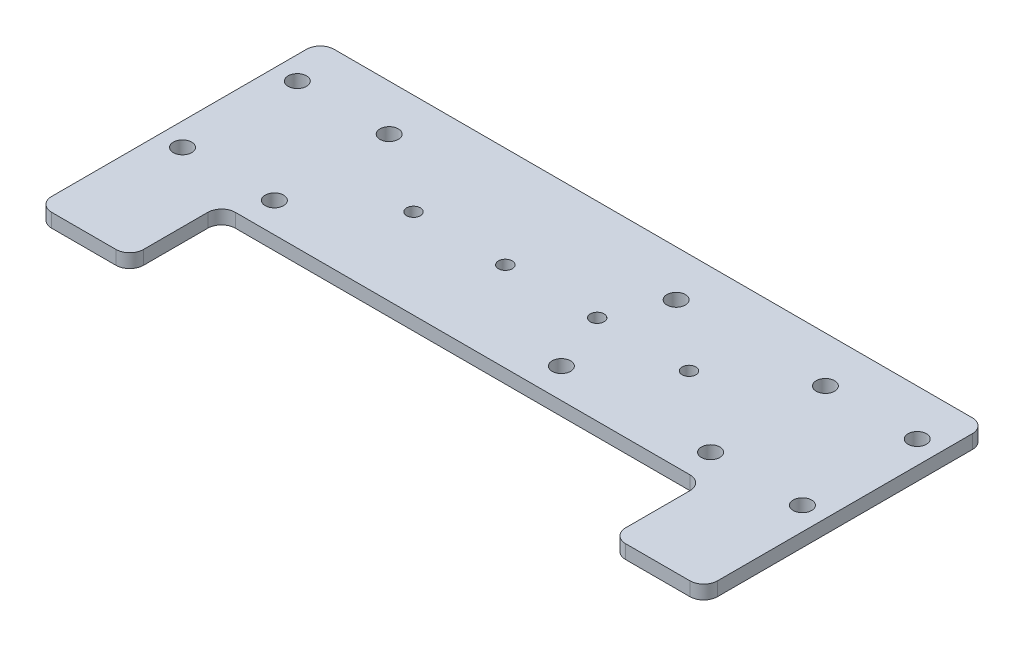
from build123d import *

# Parameters (mm, degrees)
SKETCH_1_W          = 145
SKETCH_1_H          = 61.5
SKETCH_1_R          = 2
EXTRUDE_1_DEPTH     = 3
FILLET_1_R          = 3
SKETCH_4_W          = 105
SKETCH_4_H          = 20
CUT_EXTRUDE_3_DEPTH = 6
SKETCH_6_R          = 1.5
CUT_EXTRUDE_6_DEPTH = 83.378698703
FILLET_3_R          = 3


with BuildPart() as part:
    # 草图1 → 凸台-拉伸1 (new body)
    with BuildSketch(Plane(origin=(0, 0, 0), x_dir=(1, 0, 0), z_dir=(0, 1, 0))):
        with Locations((0, -8.25)):
            Rectangle(SKETCH_1_W, SKETCH_1_H)
        with Locations(Location((-67.5, 12.5, 0), (0, 0, 270))):
            Circle(SKETCH_1_R, mode=Mode.SUBTRACT)
        with Locations(Location((-67.5, -12.5, 0), (0, 0, 270))):
            Circle(SKETCH_1_R, mode=Mode.SUBTRACT)
        with Locations(Location((67.5, 12.5, 0), (0, 0, 270))):
            Circle(SKETCH_1_R, mode=Mode.SUBTRACT)
        with Locations(Location((67.5, -12.5, 0), (0, 0, 270))):
            Circle(SKETCH_1_R, mode=Mode.SUBTRACT)
        with Locations(Location((15, 12.5, 0), (0, 0, 270))):
            Circle(SKETCH_1_R, mode=Mode.SUBTRACT)
        with Locations(Location((15, -12.5, 0), (0, 0, 270))):
            Circle(SKETCH_1_R, mode=Mode.SUBTRACT)
        with Locations(Location((-47.5, 12.5, 0), (0, 0, 270))):
            Circle(SKETCH_1_R, mode=Mode.SUBTRACT)
        with Locations(Location((-47.5, -12.5, 0), (0, 0, 270))):
            Circle(SKETCH_1_R, mode=Mode.SUBTRACT)
        with Locations(Location((47.5, 12.5, 0), (0, 0, 270))):
            Circle(SKETCH_1_R, mode=Mode.SUBTRACT)
        with Locations(Location((47.5, -12.5, 0), (0, 0, 270))):
            Circle(SKETCH_1_R, mode=Mode.SUBTRACT)
    extrude(amount=EXTRUDE_1_DEPTH)

    # 圆角1
    fillet_1_edges = [part.edges().sort_by_distance(p)[0] for p in [
        (72.5, 1.5, -22.5),
        (72.5, 1.5, 39),
        (-72.5, 1.5, 39),
        (-72.5, 1.5, -22.5),
    ]]
    fillet(fillet_1_edges, radius=FILLET_1_R)

    # 草图4 → 切除-拉伸3 (cut)
    with BuildSketch(Plane(origin=(0, 3, 0), x_dir=(1, 0, 0), z_dir=(0, 1, 0))):
        with Locations((0, -29)):
            Rectangle(SKETCH_4_W, SKETCH_4_H)
    extrude(amount=-CUT_EXTRUDE_3_DEPTH, mode=Mode.SUBTRACT)

    # 草图6 → 切除-拉伸6 (cut, through all)
    with BuildSketch(Plane(origin=(0, 3, 0), x_dir=(1, 0, 0), z_dir=(0, 1, 0))):
        with Locations(Location((-30.2, 0.5, 0), (0, 0, 270))):
            Circle(SKETCH_6_R)
        with Locations(Location((-10.2, 0.5, 0), (0, 0, 270))):
            Circle(SKETCH_6_R)
        with Locations(Location((9.8, 0.5, 0), (0, 0, 270))):
            Circle(SKETCH_6_R)
        with Locations(Location((29.8, 0.5, 0), (0, 0, 270))):
            Circle(SKETCH_6_R)
    extrude(amount=-CUT_EXTRUDE_6_DEPTH, mode=Mode.SUBTRACT)

    # 圆角3
    fillet_3_edges = [part.edges().sort_by_distance(p)[0] for p in [
        (52.5, 1.5, 39),
        (-52.5, 1.5, 39),
        (-52.5, 1.5, 19),
        (52.5, 1.5, 19),
    ]]
    fillet(fillet_3_edges, radius=FILLET_3_R)


solid = part.part
